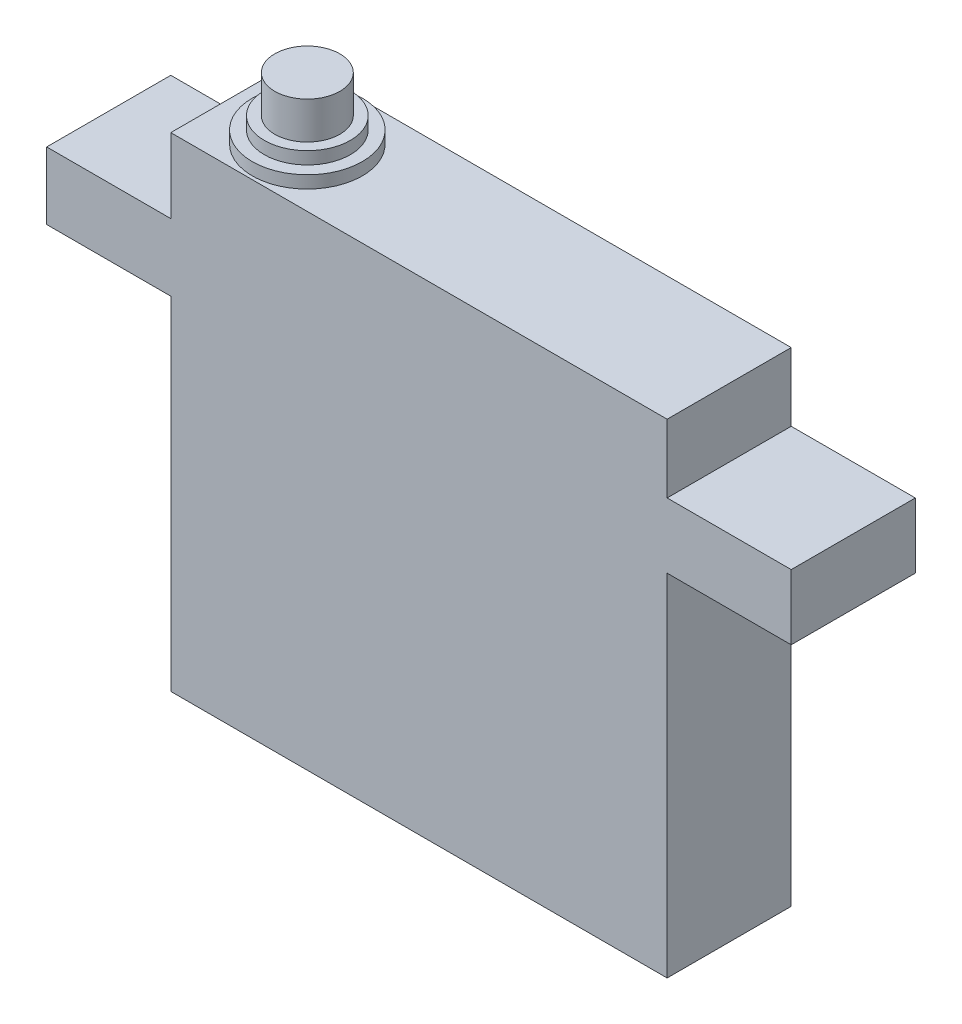
from build123d import *

# Parameters (mm, degrees)
SKETCH_1_W      = 40
SKETCH_1_H      = 39
EXTRUDE_1_DEPTH = 10
SKETCH_2_R      = 4.432676277
EXTRUDE_4_DEPTH = 1
SKETCH_3_R      = 3.469401761
EXTRUDE_5_DEPTH = 1
SKETCH_5_R      = 2.620946211
EXTRUDE_6_DEPTH = 3
SKETCH_6_W      = 10
SKETCH_6_H      = 5.416587347
EXTRUDE_7_DEPTH = 10
SKETCH_7_W      = 10
SKETCH_7_H      = 5.249064027
EXTRUDE_8_DEPTH = 10


with BuildPart() as part:
    # 草图1 → 凸台-拉伸1 (new body)
    with BuildSketch(Plane.XY):
        with Locations((-12.52596939, -9.298515699)):
            Rectangle(SKETCH_1_W, SKETCH_1_H)
    extrude(amount=EXTRUDE_1_DEPTH)

    # 草图2 → 凸台-拉伸4 (add)
    with BuildSketch(Plane(origin=(0, 10.201484301, 0), x_dir=(1, 0, 0), z_dir=(0, 1, 0))):
        with Locations(Location((-26.216270459, -5.306111922, 0), (0, 0, 90))):
            Circle(SKETCH_2_R)
    extrude(amount=EXTRUDE_4_DEPTH)

    # 草图3 → 凸台-拉伸5 (add)
    with BuildSketch(Plane(origin=(0, 11.201484301, 0), x_dir=(1, 0, 0), z_dir=(0, 1, 0))):
        with Locations(Location((-26.216270459, -5.306111922, 0), (0, 0, 270))):
            Circle(SKETCH_3_R)
    extrude(amount=EXTRUDE_5_DEPTH)

    # 草图5 → 凸台-拉伸6 (add)
    with BuildSketch(Plane(origin=(0, 12.201484301, 0), x_dir=(1, 0, 0), z_dir=(0, 1, 0))):
        with Locations(Location((-26.216270459, -5.306111922, 0), (0, 0, 270))):
            Circle(SKETCH_5_R)
    extrude(amount=EXTRUDE_6_DEPTH)

    # 草图6 → 凸台-拉伸7 (add)
    with BuildSketch(Plane.ZY.offset(32.52596939)):
        with Locations((5, 1.493888641)):
            Rectangle(SKETCH_6_W, SKETCH_6_H)
    extrude(amount=EXTRUDE_7_DEPTH)

    # 草图7 → 凸台-拉伸8 (add)
    with BuildSketch(Plane(origin=(7.47403061, 0, 0), x_dir=(0, 0, -1), z_dir=(1, 0, 0))):
        with Locations((-5, 2.080220262)):
            Rectangle(SKETCH_7_W, SKETCH_7_H)
    extrude(amount=EXTRUDE_8_DEPTH)


solid = part.part
